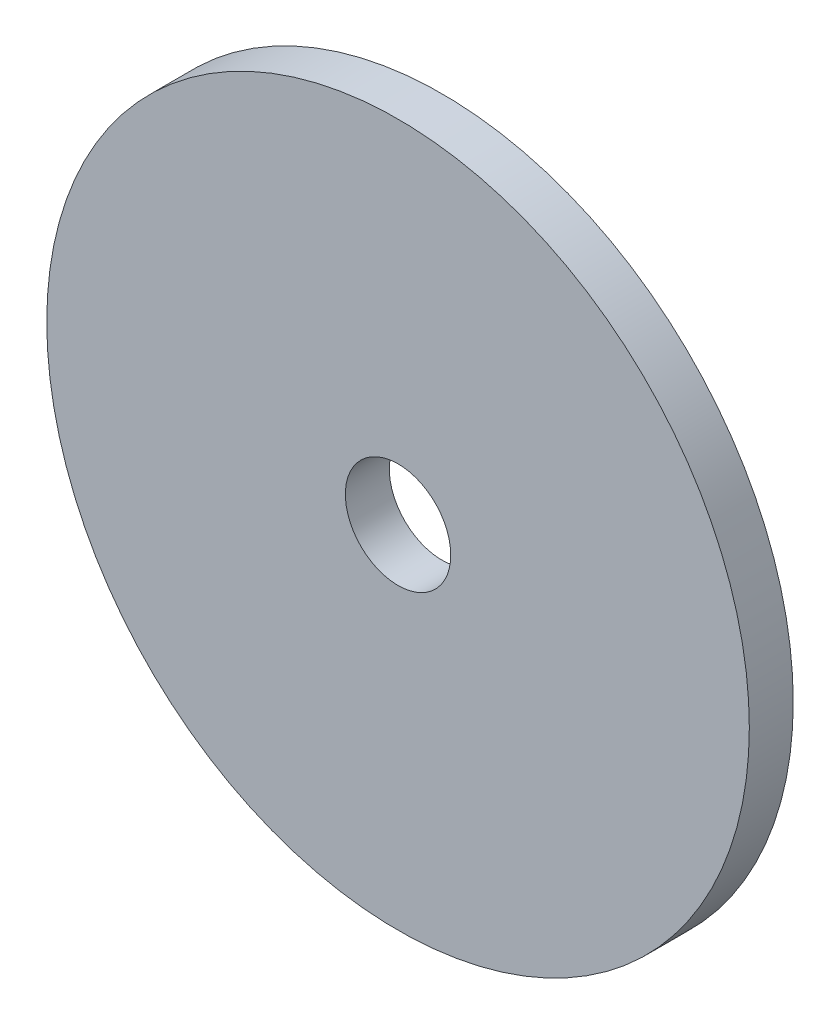
from build123d import *

# Parameters (mm, degrees)
SKETCH1_R           = 80
SKETCH1_R_2         = 12
BOSS_EXTRUDE1_DEPTH = 5
BOSS_EXTRUDE2_START = -10
SKETCH2_R           = 14.5
SKETCH2_R_2         = 12
BOSS_EXTRUDE2_DEPTH = 10
BOSS_EXTRUDE3_START = -10
SKETCH3_R           = 80
SKETCH3_R_2         = 79
BOSS_EXTRUDE3_DEPTH = 10


with BuildPart() as part:
    # Sketch1 → Boss-Extrude1 (new body)
    with BuildSketch(Plane.XY):
        Circle(SKETCH1_R)
        Circle(SKETCH1_R_2, mode=Mode.SUBTRACT)
    extrude(amount=BOSS_EXTRUDE1_DEPTH)

    # Sketch2 → Boss-Extrude2 (add)
    with BuildSketch(Plane.XY.offset(5).offset(BOSS_EXTRUDE2_START)):
        Circle(SKETCH2_R)
        Circle(SKETCH2_R_2, mode=Mode.SUBTRACT)
    extrude(amount=BOSS_EXTRUDE2_DEPTH)

    # Sketch3 → Boss-Extrude3 (add)
    with BuildSketch(Plane.XY.offset(5).offset(BOSS_EXTRUDE3_START)):
        Circle(SKETCH3_R)
        Circle(SKETCH3_R_2, mode=Mode.SUBTRACT)
    extrude(amount=BOSS_EXTRUDE3_DEPTH)


solid = part.part
